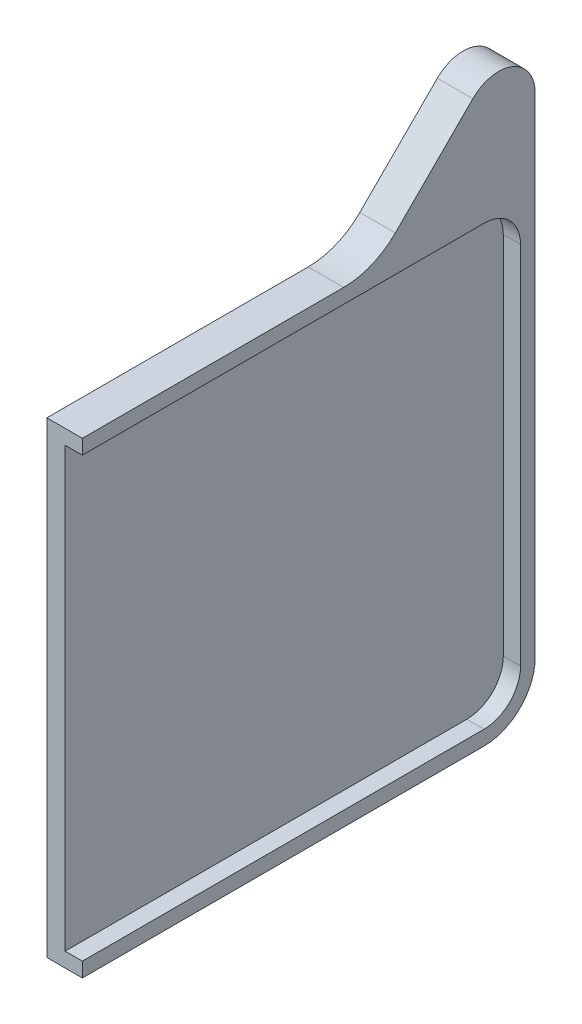
from build123d import *

# Parameters (mm, degrees)
BOSS_EXTRUDE1_DEPTH  = 3.175
EXTRUDE_THIN1_START  = -6.1722
EXTRUDE_THIN1_DEPTH  = 6.1722
BOSS_EXTRUDE2_DEPTH  = 2.9972
FILLET1_R            = 3.175
FILLET1_OF_MIRROR1_R = 3.175
BOSS_EXTRUDE3_START  = -6.1722
BOSS_EXTRUDE3_DEPTH  = 6.1722


with BuildPart() as part:
    # Sketch1 → Boss-Extrude1 (new body)
    with BuildSketch(Plane.ZY.offset(-35.1028)):
        with BuildLine():
            Line((-114.3, 38.1), (-114.3, -38.1))
            Line((-114.3, -38.1), (-184.15, -38.1))
            ThreePointArc((-184.15, -38.1), (-188.640128061, -36.240128061), (-190.5, -31.75))
            Line((-190.5, -31.75), (-190.5, 31.75))
            ThreePointArc((-190.5, 31.75), (-188.640128061, 36.240128061), (-184.15, 38.1))
            Line((-184.15, 38.1), (-114.3, 38.1))
        make_face()
    extrude(amount=BOSS_EXTRUDE1_DEPTH)

    # Sketch4 → Extrude-Thin1 (add)
    with BuildSketch(Plane.ZY.offset(-31.9278).offset(EXTRUDE_THIN1_START)):
        with BuildLine():
            Line((-114.3, 38.1), (-184.15, 38.1))
            ThreePointArc((-184.15, 38.1), (-188.640128061, 36.240128061), (-190.5, 31.75))
            Line((-190.5, 31.75), (-190.5, -31.75))
            ThreePointArc((-190.5, -31.75), (-188.640128061, -36.240128061), (-184.15, -38.1))
            Line((-184.15, -38.1), (-114.3, -38.1))
            Line((-114.3, -38.1), (-114.3, -40.64))
            Line((-114.3, -40.64), (-184.15, -40.64))
            ThreePointArc((-184.15, -40.64), (-190.436179285, -38.036179285), (-193.04, -31.75))
            Line((-193.04, -31.75), (-193.04, 31.75))
            ThreePointArc((-193.04, 31.75), (-190.436179285, 38.036179285), (-184.15, 40.64))
            Line((-184.15, 40.64), (-114.3, 40.64))
            Line((-114.3, 40.64), (-114.3, 38.1))
        make_face()
    extrude(amount=EXTRUDE_THIN1_DEPTH)

    # Sketch5 → Boss-Extrude2 (add)
    with BuildSketch(Plane.ZY.offset(-31.9278)):
        with BuildLine():
            Line((-177.8, 15.875), (-171.45, 15.875))
            Line((-171.45, 15.875), (-170.350147737, 15.24))
            Line((-170.350147737, 15.24), (-128.099852263, 15.24))
            Line((-128.099852263, 15.24), (-127, 15.875))
            Line((-127, 15.875), (-120.65, 15.875))
            ThreePointArc((-120.65, 15.875), (-117.475, 12.7), (-120.65, 9.525))
            Line((-120.65, 9.525), (-127, 9.525))
            Line((-127, 9.525), (-128.099852263, 10.16))
            Line((-128.099852263, 10.16), (-170.350147737, 10.16))
            Line((-170.350147737, 10.16), (-171.45, 9.525))
            Line((-171.45, 9.525), (-177.8, 9.525))
            ThreePointArc((-177.8, 9.525), (-180.975, 12.7), (-177.8, 15.875))
        make_face()
    boss_extrude2 = extrude(amount=BOSS_EXTRUDE2_DEPTH)

    # Fillet1
    fillet1_edges = [part.edges().sort_by_distance(p)[0] for p in [
        (30.4292, 15.875, -171.45),
        (30.4292, 9.525, -171.45),
        (30.4292, 9.525, -127),
        (30.4292, 15.875, -127),
    ]]
    fillet(fillet1_edges, radius=FILLET1_R)

    # Mirror1: Boss-Extrude2 across plane
    add(boss_extrude2.mirror(Plane.ZX))

    # Fillet1 of Mirror1
    fillet1_of_mirror1_edges = [part.edges().sort_by_distance(p)[0] for p in [
        (30.4292, -15.875, -171.45),
        (30.4292, -9.525, -171.45),
        (30.4292, -9.525, -127),
        (30.4292, -15.875, -127),
    ]]
    fillet(fillet1_of_mirror1_edges, radius=FILLET1_OF_MIRROR1_R)

    # Sketch6 → Boss-Extrude3 (add)
    with BuildSketch(Plane.ZY.offset(-31.9278).offset(BOSS_EXTRUDE3_START)):
        with BuildLine():
            Line((-193.04, 53.34), (-193.04, 31.75))
            ThreePointArc((-193.04, 31.75), (-190.436179285, 38.036179285), (-184.15, 40.64))
            Line((-184.15, 40.64), (-159.749231637, 40.64))
            ThreePointArc((-159.749231637, 40.64), (-164.609311228, 41.606729937), (-168.729487758, 44.359743879))
            Line((-168.729487758, 44.359743879), (-182.199871939, 57.830128061))
            ThreePointArc((-182.199871939, 57.830128061), (-189.120039796, 59.206635031), (-193.04, 53.34))
        make_face()
    extrude(amount=BOSS_EXTRUDE3_DEPTH)


solid = part.part
